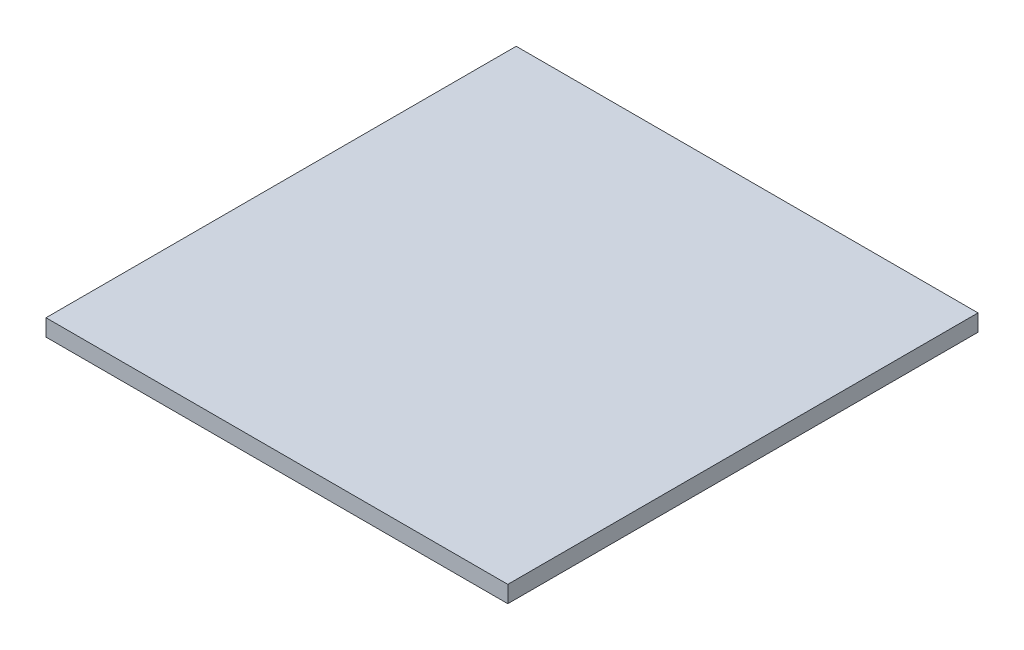
from build123d import *

# Parameters (mm, degrees)
IZIM1_W                     = 280
IZIM1_H                     = 10
Y_KSEKLIK_EKSTR_ZYON1_DEPTH = 275


with BuildPart() as part:
    # Çizim1 → Yükseklik-Ekstrüzyon1 (new body)
    with BuildSketch(Plane(origin=(0, 0, 0), x_dir=(0, 0, -1), z_dir=(1, 0, 0))):
        with Locations((140, 5)):
            Rectangle(IZIM1_W, IZIM1_H)
    extrude(amount=Y_KSEKLIK_EKSTR_ZYON1_DEPTH)


solid = part.part
